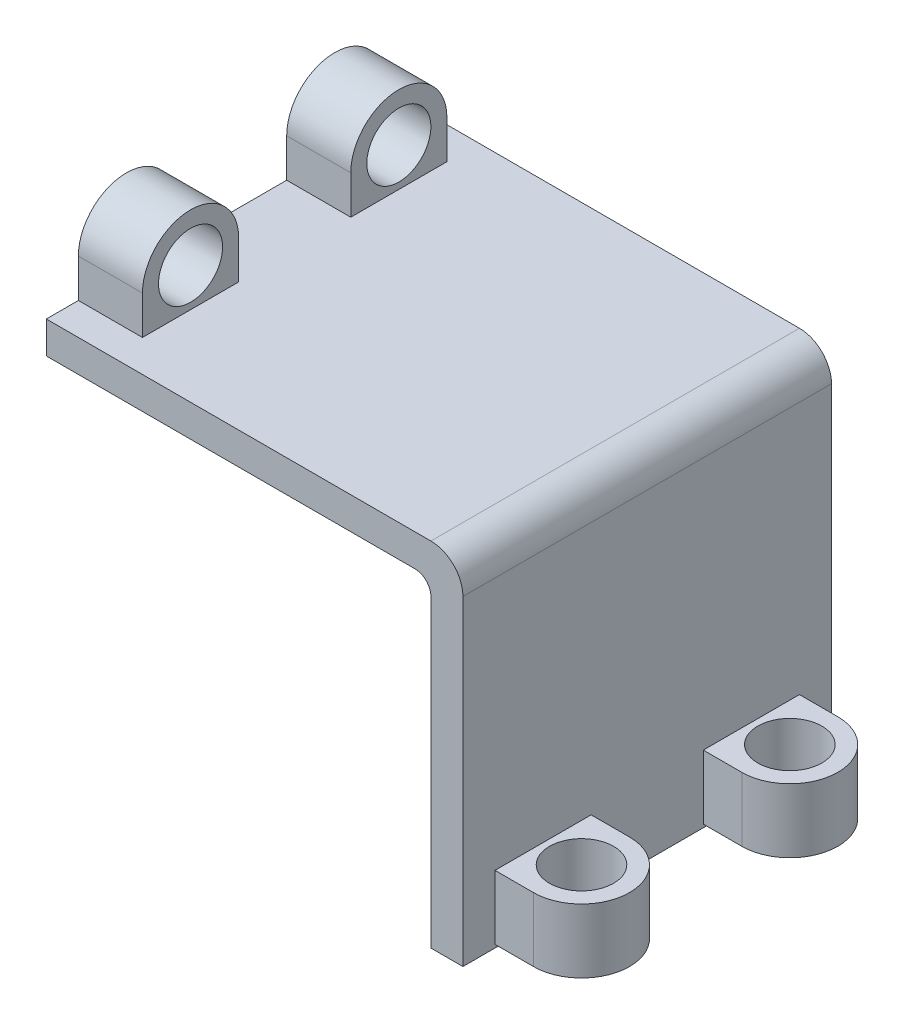
from build123d import *

# Parameters (mm, degrees)
BOSS_EXTRUDE2_DEPTH = 11.5
SKETCH5_R           = 1
BOSS_EXTRUDE5_DEPTH = 2
SKETCH3_R           = 1
BOSS_EXTRUDE6_DEPTH = 2


with BuildPart() as part:
    # Sketch1 → Boss-Extrude2 (new body)
    with BuildSketch(Plane.XY):
        with BuildLine():
            Line((0, 0), (1, 0))
            Line((1, 0), (1, 10))
            ThreePointArc((1, 10), (0.707106781, 10.707106781), (0, 11))
            Line((0, 11), (-12, 11))
            Line((-12, 11), (-12, 10))
            Line((-12, 10), (-0.5, 10))
            ThreePointArc((-0.5, 10), (-0.146446609, 9.853553391), (0, 9.5))
            Line((0, 9.5), (0, 0))
        make_face()
    extrude(amount=BOSS_EXTRUDE2_DEPTH)

    # Sketch5 → Boss-Extrude5 (add)
    with BuildSketch(Plane.ZY.offset(12)):
        with BuildLine():
            Line((7.5, 11), (10.5, 11))
            Line((10.5, 11), (10.5, 12.2))
            ThreePointArc((10.5, 12.2), (9, 13.7), (7.5, 12.2))
            Line((7.5, 12.2), (7.5, 11))
        make_face()
        with Locations(Location((9, 12.2, 0), (0, 0, 270))):
            Circle(SKETCH5_R, mode=Mode.SUBTRACT)
    boss_extrude5 = extrude(amount=-BOSS_EXTRUDE5_DEPTH)

    # Sketch3 → Boss-Extrude6 (add)
    with BuildSketch(Plane(origin=(0, 0.1, 0), x_dir=(-1, 0, 0), z_dir=(0, -1, 0))):
        with BuildLine():
            Line((-1, -10.5), (-1, -7.5))
            Line((-1, -7.5), (-2.2, -7.5))
            ThreePointArc((-2.2, -7.5), (-3.7, -9), (-2.2, -10.5))
            Line((-2.2, -10.5), (-1, -10.5))
        make_face()
        with Locations(Location((-2.2, -9, 0), (0, 0, 90))):
            Circle(SKETCH3_R, mode=Mode.SUBTRACT)
    boss_extrude6 = extrude(amount=-BOSS_EXTRUDE6_DEPTH)

    # Mirror1: Boss-Extrude5, Boss-Extrude6 across plane
    add(boss_extrude5.mirror(Plane(origin=(0, 0, 5.75), x_dir=(1, 0, 0), z_dir=(0, 0, -1))))
    add(boss_extrude6.mirror(Plane(origin=(0, 0, 5.75), x_dir=(1, 0, 0), z_dir=(0, 0, -1))))


solid = part.part
